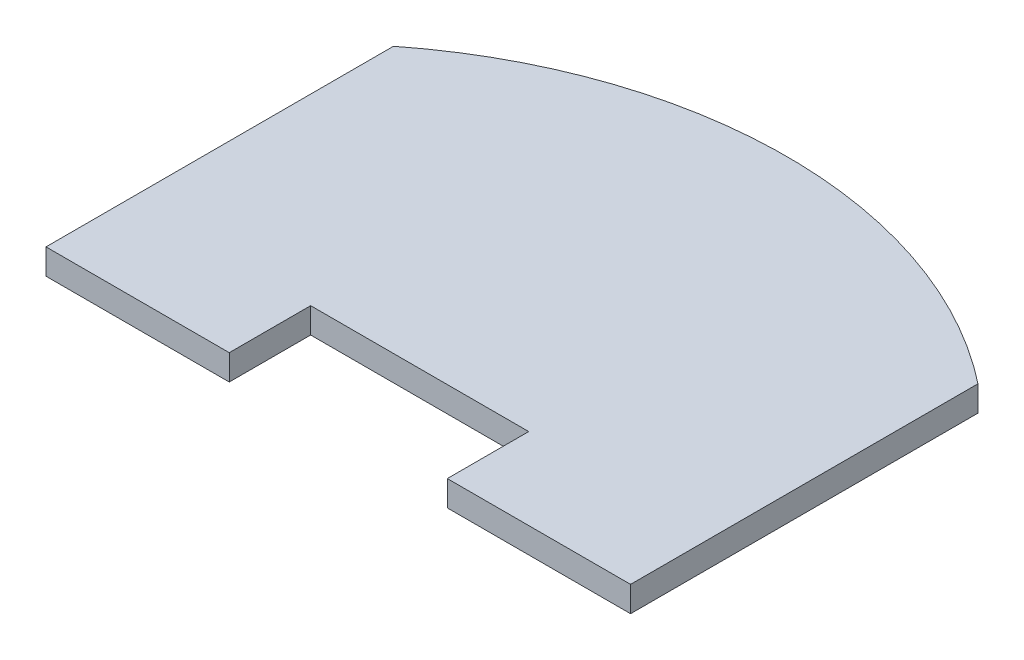
from build123d import *

# Parameters (mm, degrees)
BOSS_EXTRUDE2_DEPTH = 4.445


with BuildPart() as part:
    # Sketch1 → Boss-Extrude2 (new body)
    with BuildSketch(Plane(origin=(0, 0, 0), x_dir=(1, 0, 0), z_dir=(0, 1, 0))):
        with BuildLine():
            Line((-51.06889371, 4.150009473), (-51.06889371, 64.857309497))
            ThreePointArc((-51.06889371, 64.857309497), (0, 82.55), (51.06889371, 64.857309497))
            Line((51.06889371, 64.857309497), (51.06889371, 4.150009473))
            Line((51.06889371, 4.150009473), (19.05, 4.150009473))
            Line((19.05, 4.150009473), (19.05, 14.2875))
            Line((19.05, 14.2875), (19.05, 18.374009473))
            Line((19.05, 18.374009473), (-19.05, 18.374009473))
            Line((-19.05, 18.374009473), (-19.05, 14.2875))
            Line((-19.05, 14.2875), (-19.05, 4.150009473))
            Line((-19.05, 4.150009473), (-51.06889371, 4.150009473))
        make_face()
    extrude(amount=BOSS_EXTRUDE2_DEPTH)


solid = part.part
